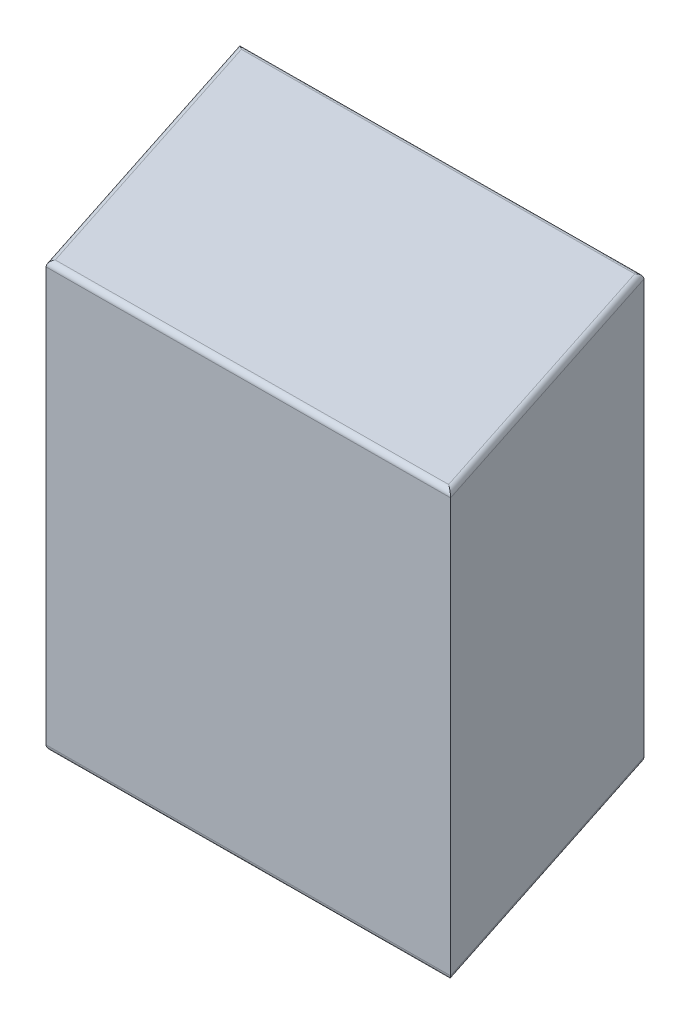
from build123d import *

# Parameters (mm, degrees)
BOSS_EXTRUDE1_DEPTH = 40
FILLET1_R           = 0.5


with BuildPart() as part:
    # Sketch1 → Boss-Extrude1 (new body)
    with BuildSketch(Plane(origin=(0, 0, 0), x_dir=(-1, 0, 0), z_dir=(0, 1, 0))):
        Polygon((-0.376890979, 0.083720177), (8.363244284, -26.866668495), (-29.537452899, -27.083722916), (-38.277588162, -0.133334243), align=None)
    extrude(amount=BOSS_EXTRUDE1_DEPTH)

    # Fillet1
    fillet1_edges = [part.edges().sort_by_distance(p)[0] for p in [
        (10.587104308, 40, -26.975195705),
        (-3.993176653, 40, -13.391474159),
        (19.32723957, 40, -0.024807033),
        (-3.993176653, 0, -13.391474159),
        (10.587104308, 0, -26.975195705),
        (33.907520531, 0, -13.608528579),
        (19.32723957, 0, -0.024807033),
        (33.907520531, 40, -13.608528579),
    ]]
    fillet(fillet1_edges, radius=FILLET1_R)


solid = part.part
